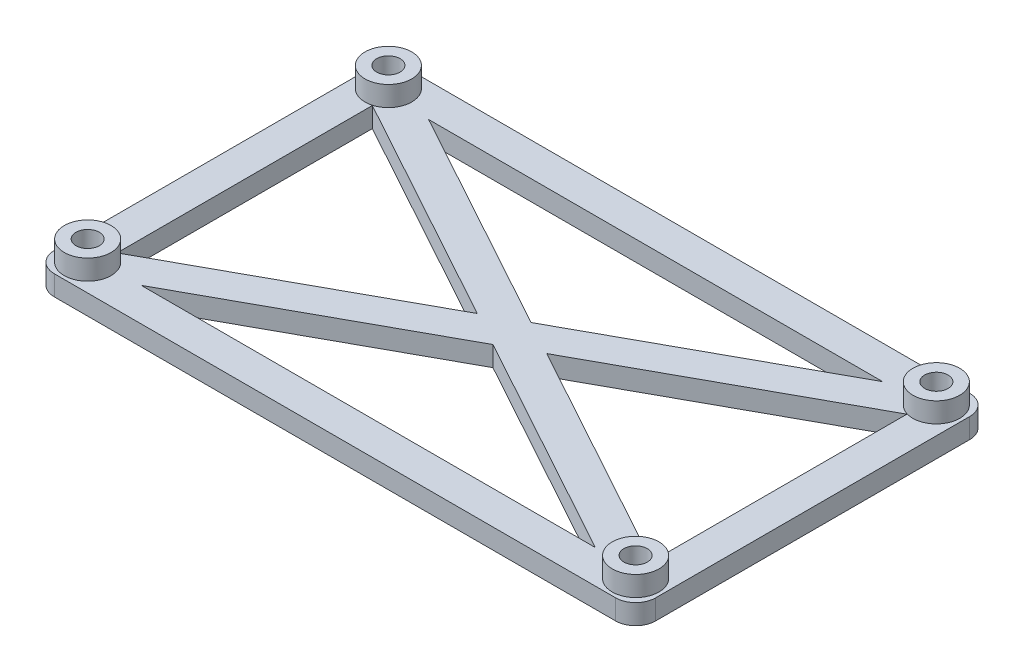
from build123d import *

# Parameters (mm, degrees)
CROQUIS1_W              = 90
CROQUIS1_H              = 53
SALIENTE_EXTRUIR1_DEPTH = 3
CROQUIS2_R              = 1.75
CORTAR_EXTRUIR1_DEPTH   = 53.309177015
CROQUIS3_R              = 3.5
CROQUIS3_R_2            = 1.75
SALIENTE_EXTRUIR2_DEPTH = 3
REDONDEO1_R             = 3
CORTAR_EXTRUIR2_DEPTH   = 53.566624392


with BuildPart() as part:
    # Croquis1 → Saliente-Extruir1 (new body)
    with BuildSketch(Plane(origin=(0, 0, 0), x_dir=(1, 0, 0), z_dir=(0, 1, 0))):
        Rectangle(CROQUIS1_W, CROQUIS1_H)
    extrude(amount=SALIENTE_EXTRUIR1_DEPTH)

    # Croquis2 → Cortar-Extruir1 (cut, through all)
    with BuildSketch(Plane.XZ):
        with Locations(Location((41, -22.5, 0), (0, 0, 270))):
            Circle(CROQUIS2_R)
        with Locations(Location((41, 22.5, 0), (0, 0, 270))):
            Circle(CROQUIS2_R)
        with Locations(Location((-41, 22.5, 0), (0, 0, 270))):
            Circle(CROQUIS2_R)
        with Locations(Location((-41, -22.5, 0), (0, 0, 270))):
            Circle(CROQUIS2_R)
    extrude(amount=-CORTAR_EXTRUIR1_DEPTH, mode=Mode.SUBTRACT)

    # Croquis3 → Saliente-Extruir2 (add)
    # profile 1 of 2: a face of its own
    with BuildSketch(Plane(origin=(0, 3, 0), x_dir=(1, 0, 0), z_dir=(0, 1, 0))):
        with Locations(Location((41, 22.5, 0), (0, 0, 270))):
            Circle(CROQUIS3_R)
        with Locations(Location((41, 22.5, 0), (0, 0, 90))):
            Circle(CROQUIS3_R_2, mode=Mode.SUBTRACT)
    # profile 2 of 2: a face of its own
    with BuildSketch(Plane(origin=(0, 3, 0), x_dir=(1, 0, 0), z_dir=(0, 1, 0))):
        with Locations(Location((-41, 22.5, 0), (0, 0, 270))):
            Circle(CROQUIS3_R)
        with Locations(Location((-41, 22.5, 0), (0, 0, 90))):
            Circle(CROQUIS3_R_2, mode=Mode.SUBTRACT)
    saliente_extruir2 = extrude(amount=SALIENTE_EXTRUIR2_DEPTH)

    # Simetría1: Saliente-Extruir2 across plane
    add(saliente_extruir2.mirror(Plane.XY))

    # Redondeo1
    redondeo1_edges = [part.edges().sort_by_distance(p)[0] for p in [
        (-45, 1.5, -26.5),
        (45, 1.5, -26.5),
        (45, 1.5, 26.5),
        (-45, 1.5, 26.5),
    ]]
    fillet(redondeo1_edges, radius=REDONDEO1_R)

    # Croquis4 → Cortar-Extruir2 (cut, through all)
    with BuildSketch(Plane.XZ):
        Polygon((33.981328373, 21.5), (0, 2.851710039), (-33.981328373, 21.5), align=None)
        Polygon((-40, 19.099509473), (-5.196449405, 0), (-40, -19.099509473), align=None)
        Polygon((40, 19.099509473), (5.196449405, 0), (40, -19.099509473), align=None)
        Polygon((33.981328373, -21.5), (-33.981328373, -21.5), (0, -2.851710039), align=None)
    extrude(amount=-CORTAR_EXTRUIR2_DEPTH, mode=Mode.SUBTRACT)


solid = part.part
